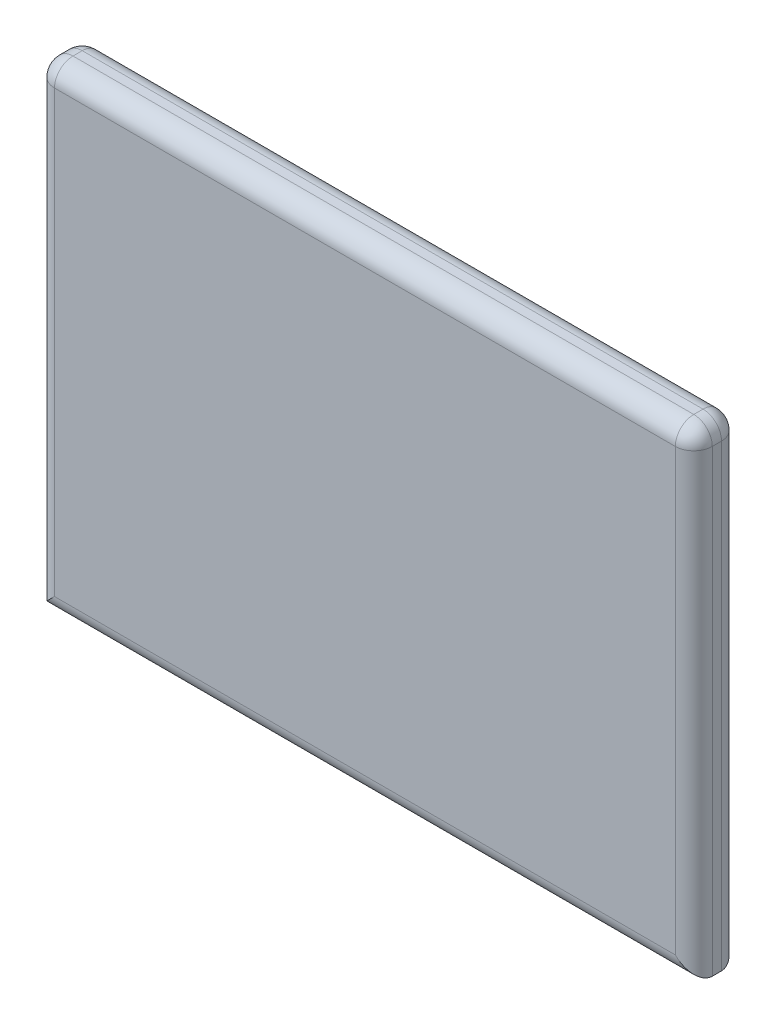
from build123d import *

# Parameters (mm, degrees)
ESQUISSE1_W             = 356
ESQUISSE1_H             = 258.34
BOSS_EXTRU_1_DEPTH      = 25
CONG_1_R                = 10
BOSS_EXTRU_2_DEPTH      = 35
ESQUISSE4_W             = 200
ESQUISSE4_H             = 8
ENL_V_MAT_EXTRU_1_DEPTH = 3


with BuildPart() as part:
    # Esquisse1 → Boss.-Extru.1 (new body)
    with BuildSketch(Plane.XY):
        Rectangle(ESQUISSE1_W, ESQUISSE1_H)
    extrude(amount=BOSS_EXTRU_1_DEPTH)

    # Congé1
    cong_1_edges = [part.edges().sort_by_distance(p)[0] for p in [
        (178, 0, 25),
        (0, 129.17, 25),
        (-178, 0, 25),
        (0, 129.17, 0),
        (178, 0, 0),
        (0, -129.17, 0),
        (-178, 0, 0),
        (-178, 129.17, 12.5),
        (178, 129.17, 12.5),
        (0, -129.17, 25),
    ]]
    fillet(cong_1_edges, radius=CONG_1_R)

    # Esquisse3 → Boss.-Extru.2 (add)
    with BuildSketch(Plane(origin=(120, 0, 0), x_dir=(0, 0, -1), z_dir=(1, 0, 0))):
        with BuildLine():
            Line((0, 101.177924123), (0, 79.066125458))
            add(Edge.make_bspline(
                [(0, 79.066125458), (8.012390786, 75.823605097), (5.511301078, 85.583926919), (8.019330137, 90.12202479)],
                knots=[0, 0, 0, 0, 1, 1, 1, 1], degree=3))
            add(Edge.make_bspline(
                [(0, 101.177924123), (8.012390786, 104.420444484), (5.511301078, 94.660122661), (8.019330137, 90.12202479)],
                knots=[0, 0, 0, 0, 1, 1, 1, 1], degree=3))
        make_face()
    boss_extru_2 = extrude(amount=BOSS_EXTRU_2_DEPTH)

    # Symétrie1: Boss.-Extru.2 across plane
    add(boss_extru_2.mirror(Plane(origin=(0, 0, 0), x_dir=(0, 0, 1), z_dir=(1, 0, 0))))

    # Esquisse4 → Enlèv. mat.-Extru.1 (cut)
    with BuildSketch(Plane.XZ.offset(129.17)):
        with Locations((0, 12.5)):
            Rectangle(ESQUISSE4_W, ESQUISSE4_H)
    extrude(amount=-ENL_V_MAT_EXTRU_1_DEPTH, mode=Mode.SUBTRACT)


solid = part.part
